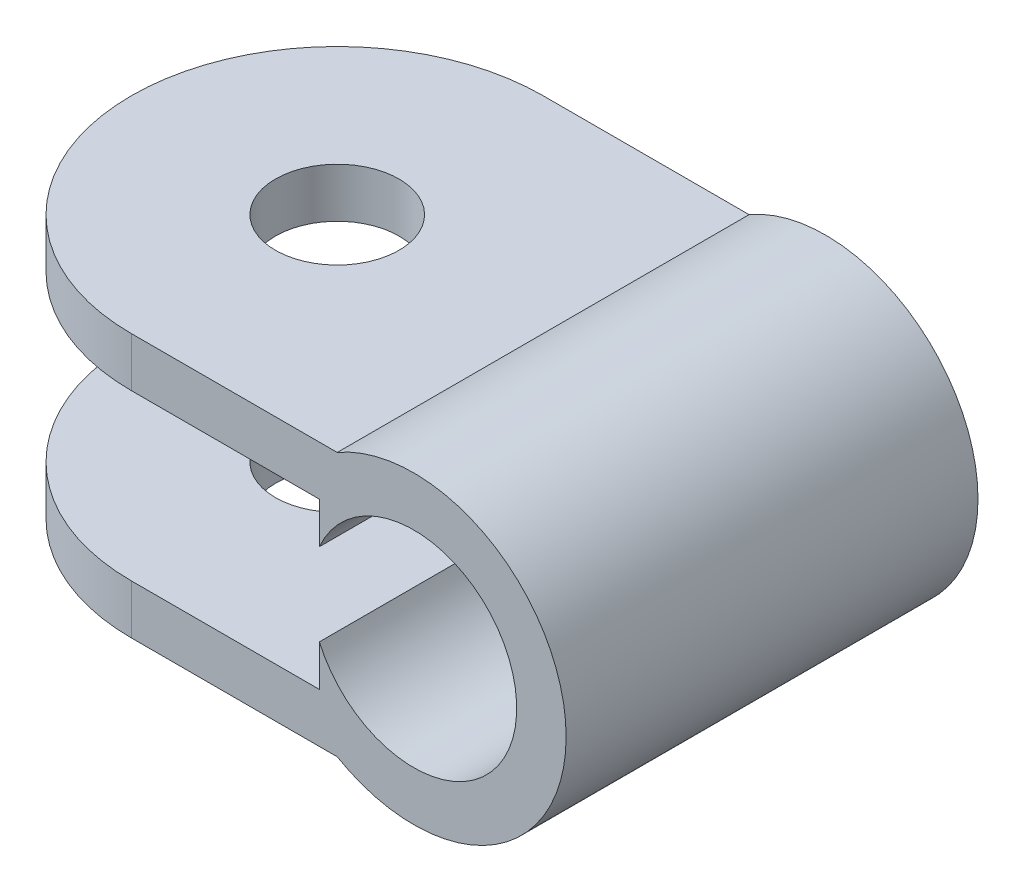
from build123d import *

# Parameters (mm, degrees)
BOSS_EXTRUDE1_DEPTH = 5
SKETCH2_R           = 1.5
CUT_EXTRUDE1_DEPTH  = 10


with BuildPart() as part:
    # Sketch1 → Boss-Extrude1 (new, symmetric)
    with BuildSketch(Plane.XY):
        with BuildLine():
            Line((-11.857417562, 2), (-11.857417562, 3.2))
            Line((-11.857417562, 3.2), (-1.857417562, 3.2))
            ThreePointArc((-1.857417562, 3.2), (3.7, 0), (-1.857417562, -3.2))
            Line((-1.857417562, -3.2), (-11.857417562, -3.2))
            Line((-11.857417562, -3.2), (-11.857417562, -2))
            Line((-11.857417562, -2), (-2.291287847, -2))
            Line((-2.291287847, -2), (-2.291287847, -1))
            ThreePointArc((-2.291287847, -1), (2.5, 0), (-2.291287847, 1))
            Line((-2.291287847, 1), (-2.291287847, 2))
            Line((-2.291287847, 2), (-11.857417562, 2))
        make_face()
    extrude(amount=BOSS_EXTRUDE1_DEPTH, both=True)

    # Sketch2 → Cut-Extrude1 (cut)
    with BuildSketch(Plane(origin=(0, 3.2, 0), x_dir=(1, 0, 0), z_dir=(0, 1, 0))):
        with Locations(Location((-6.857417562, 0, 0), (0, 0, 180))):
            Circle(SKETCH2_R)
        with BuildLine():
            Line((-6.857417562, 5), (-12.857417562, 5))
            Line((-12.857417562, 5), (-12.857417562, -5))
            Line((-12.857417562, -5), (-6.857417562, -5))
            ThreePointArc((-6.857417562, -5), (-11.857417562, 0), (-6.857417562, 5))
        make_face()
    extrude(amount=-CUT_EXTRUDE1_DEPTH, mode=Mode.SUBTRACT)


solid = part.part
